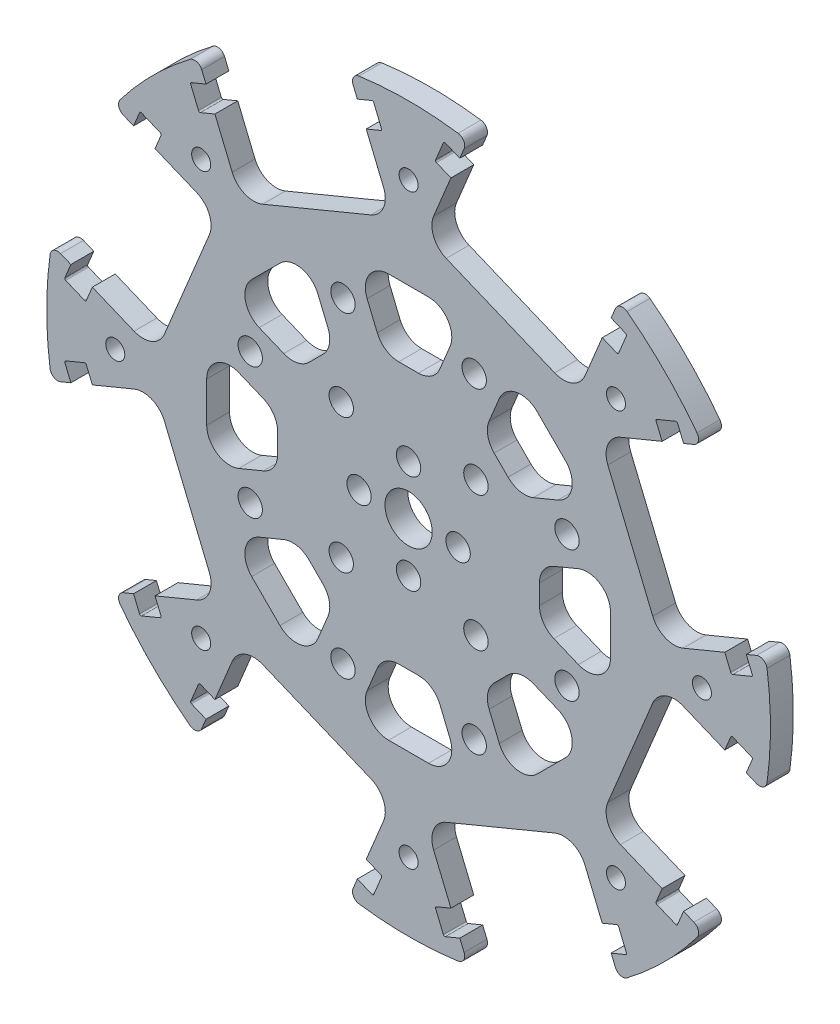
from build123d import *

# Parameters (mm, degrees)
SKETCH_1_R                       = 47.5
EXTRUDE_1_DEPTH                  = 3
CUT_EXTRUDE_1_DEPTH              = 68.242099908
CUT_EXTRUDE_2_DEPTH              = 68.242099908
CUT_EXTRUDE_2_DEPTH_BACK         = 68.242099908
SKETCH_3_R                       = 3.1
SKETCH_3_R_2                     = 1.6
SKETCH_4_R                       = 1.25
SKETCH_4_R_2                     = 1.6
CUT_EXTRUDE_3_DEPTH              = 68.242099908
CUT_EXTRUDE_4_DEPTH              = 68.242099908
FILLET_1_R                       = 1
FILLET_2_R                       = 0.2
FILLET_3_R                       = 3.05
FILLET_4_R                       = 3.05
PATTERN_CIRCULAR_1_COUNT         = 8
FILLET_1_OF_PATTERN_CIRCULAR_1_R = 1
FILLET_2_OF_PATTERN_CIRCULAR_1_R = 0.2
FILLET_3_OF_PATTERN_CIRCULAR_1_R = 3.05
FILLET_4_OF_PATTERN_CIRCULAR_1_R = 3.05


with BuildPart() as part:
    # ｽｹｯﾁ1 → ﾎﾞｽ - 押し出し1 (new body)
    with BuildSketch(Plane.XY):
        Circle(SKETCH_1_R)
    extrude(amount=EXTRUDE_1_DEPTH)

    # ｽｹｯﾁ2 → ｶｯﾄ - 押し出し1 (cut, through all)
    with BuildSketch(Plane.XY.offset(3)):
        Polygon((6.724591419, 44.32570355), (10.159175225, 52.617522355), (30.022585174, 44.389828559), (26.588001368, 36.098009755), (28.666730316, 35.236972032), (27.499545848, 32.419139458), (25.420816899, 33.28017718), (21.986233094, 24.988358376), (2.122823145, 33.216052172), (5.55740695, 41.507870976), (3.478678002, 42.368908699), (4.645862471, 45.186741273), align=None)
    cut_extrude_1 = extrude(amount=-CUT_EXTRUDE_1_DEPTH, mode=Mode.SUBTRACT)

    # ｽｹｯﾁ3 → ｶｯﾄ - 押し出し2 (cut, two sides: drawn at the far end of the back side and taken through both)
    with BuildSketch(Plane.XY.offset(3).offset(-CUT_EXTRUDE_2_DEPTH_BACK)):
        Circle(SKETCH_3_R)
        with Locations((0, 6.5)):
            Circle(SKETCH_3_R_2)
        with Locations((6.5, 0)):
            Circle(SKETCH_3_R_2)
        with Locations((0, -6.5)):
            Circle(SKETCH_3_R_2)
        with Locations((-6.5, 0)):
            Circle(SKETCH_3_R_2)
        with Locations((8.838834765, 8.838834765)):
            Circle(SKETCH_3_R_2)
        with Locations((8.838834765, -8.838834765)):
            Circle(SKETCH_3_R_2)
        with Locations((-8.838834765, -8.838834765)):
            Circle(SKETCH_3_R_2)
        with Locations((-8.838834765, 8.838834765)):
            Circle(SKETCH_3_R_2)
    extrude(amount=CUT_EXTRUDE_2_DEPTH + CUT_EXTRUDE_2_DEPTH_BACK, mode=Mode.SUBTRACT)

    # ｽｹｯﾁ4 → ｶｯﾄ - 押し出し3 (cut, through all)
    with BuildSketch(Plane.XY.offset(3)):
        with Locations((27.223611076, 27.223611076)):
            Circle(SKETCH_4_R)
        with Locations((8.610377228, 20.787289482)):
            Circle(SKETCH_4_R_2)
    cut_extrude_3 = extrude(amount=-CUT_EXTRUDE_3_DEPTH, mode=Mode.SUBTRACT)

    # ｽｹｯﾁ5 → ｶｯﾄ - 押し出し4 (cut, symmetric)
    with BuildSketch(Plane.XY.offset(3)):
        Polygon((3.328075632, 17.180626082), (7.188286702, 26.5), (-7.188286702, 26.5), (-3.328075632, 17.180626082), align=None)
    cut_extrude_4 = extrude(amount=CUT_EXTRUDE_4_DEPTH, both=True, mode=Mode.SUBTRACT)

    # ﾌｨﾚｯﾄ1
    fillet_1_edges = [part.edges().sort_by_distance(p)[0] for p in [
        (27.637535262, 38.631808716, 1.5),
        (7.774125313, 46.859502511, 1.5),
    ]]
    fillet(fillet_1_edges, radius=FILLET_1_R)

    # ﾌｨﾚｯﾄ2
    fillet_2_edges = [part.edges().sort_by_distance(p)[0] for p in [
        (28.666730316, 35.236972032, 1.5),
        (27.499545848, 32.419139458, 1.5),
        (4.645862471, 45.186741273, 1.5),
        (3.478678002, 42.368908699, 1.5),
    ]]
    fillet(fillet_2_edges, radius=FILLET_2_R)

    # ﾌｨﾚｯﾄ3
    fillet_3_edges = [part.edges().sort_by_distance(p)[0] for p in [
        (21.986233094, 24.988358376, 1.5),
        (2.122823145, 33.216052172, 1.5),
    ]]
    fillet(fillet_3_edges, radius=FILLET_3_R)

    # ﾌｨﾚｯﾄ4
    fillet_4_edges = [part.edges().sort_by_distance(p)[0] for p in [
        (7.188286702, 26.5, 1.5),
        (-7.188286702, 26.5, 1.5),
        (3.328075632, 17.180626082, 1.5),
        (-3.328075632, 17.180626082, 1.5),
    ]]
    fillet(fillet_4_edges, radius=FILLET_4_R)

    # 円形ﾊﾟﾀｰﾝ1: ｶｯﾄ - 押し出し1, ｶｯﾄ - 押し出し3, ｶｯﾄ - 押し出し4 ×8 about axis
    pattern_circular_1_axis = Axis((0, 0, 0), (0, 0, 1))
    add([cut_extrude_1.rotate(pattern_circular_1_axis, i * 360 / PATTERN_CIRCULAR_1_COUNT) for i in range(1, PATTERN_CIRCULAR_1_COUNT)], mode=Mode.SUBTRACT)
    add([cut_extrude_3.rotate(pattern_circular_1_axis, i * 360 / PATTERN_CIRCULAR_1_COUNT) for i in range(1, PATTERN_CIRCULAR_1_COUNT)], mode=Mode.SUBTRACT)
    add([cut_extrude_4.rotate(pattern_circular_1_axis, i * 360 / PATTERN_CIRCULAR_1_COUNT) for i in range(1, PATTERN_CIRCULAR_1_COUNT)], mode=Mode.SUBTRACT)

    # ﾌｨﾚｯﾄ1 of 円形ﾊﾟﾀｰﾝ1
    fillet_1_of_pattern_circular_1_edges = [part.edges().sort_by_distance(p)[0] for p in [
        (-7.774125313, 46.859502511, 1.5),
        (-27.637535262, 38.631808716, 1.5),
        (-38.631808716, 27.637535262, 1.5),
        (-46.859502511, 7.774125313, 1.5),
        (-46.859502511, -7.774125313, 1.5),
        (-38.631808716, -27.637535262, 1.5),
        (-27.637535262, -38.631808716, 1.5),
        (-7.774125313, -46.859502511, 1.5),
        (7.774125313, -46.859502511, 1.5),
        (27.637535262, -38.631808716, 1.5),
        (38.631808716, -27.637535262, 1.5),
        (46.859502511, -7.774125313, 1.5),
        (46.859502511, 7.774125313, 1.5),
        (38.631808716, 27.637535262, 1.5),
    ]]
    fillet(fillet_1_of_pattern_circular_1_edges, radius=FILLET_1_OF_PATTERN_CIRCULAR_1_R)

    # ﾌｨﾚｯﾄ2 of 円形ﾊﾟﾀｰﾝ1
    fillet_2_of_pattern_circular_1_edges = [part.edges().sort_by_distance(p)[0] for p in [
        (-4.645862471, 45.186741273, 1.5),
        (-3.478678002, 42.368908699, 1.5),
        (-28.666730316, 35.236972032, 1.5),
        (-27.499545848, 32.419139458, 1.5),
        (-35.236972032, 28.666730316, 1.5),
        (-32.419139458, 27.499545848, 1.5),
        (-45.186741273, 4.645862471, 1.5),
        (-42.368908699, 3.478678002, 1.5),
        (-45.186741273, -4.645862471, 1.5),
        (-42.368908699, -3.478678002, 1.5),
        (-35.236972032, -28.666730316, 1.5),
        (-32.419139458, -27.499545848, 1.5),
        (-28.666730316, -35.236972032, 1.5),
        (-27.499545848, -32.419139458, 1.5),
        (-4.645862471, -45.186741273, 1.5),
        (-3.478678002, -42.368908699, 1.5),
        (4.645862471, -45.186741273, 1.5),
        (3.478678002, -42.368908699, 1.5),
        (28.666730316, -35.236972032, 1.5),
        (27.499545848, -32.419139458, 1.5),
        (35.236972032, -28.666730316, 1.5),
        (32.419139458, -27.499545848, 1.5),
        (45.186741273, -4.645862471, 1.5),
        (42.368908699, -3.478678002, 1.5),
        (45.186741273, 4.645862471, 1.5),
        (42.368908699, 3.478678002, 1.5),
        (35.236972032, 28.666730316, 1.5),
        (32.419139458, 27.499545848, 1.5),
    ]]
    fillet(fillet_2_of_pattern_circular_1_edges, radius=FILLET_2_OF_PATTERN_CIRCULAR_1_R)

    # ﾌｨﾚｯﾄ3 of 円形ﾊﾟﾀｰﾝ1
    fillet_3_of_pattern_circular_1_edges = [part.edges().sort_by_distance(p)[0] for p in [
        (-2.122823145, 33.216052172, 1.5),
        (-21.986233094, 24.988358376, 1.5),
        (-24.988358376, 21.986233094, 1.5),
        (-33.216052172, 2.122823145, 1.5),
        (-33.216052172, -2.122823145, 1.5),
        (-24.988358376, -21.986233094, 1.5),
        (-21.986233094, -24.988358376, 1.5),
        (-2.122823145, -33.216052172, 1.5),
        (2.122823145, -33.216052172, 1.5),
        (21.986233094, -24.988358376, 1.5),
        (24.988358376, -21.986233094, 1.5),
        (33.216052172, -2.122823145, 1.5),
        (33.216052172, 2.122823145, 1.5),
        (24.988358376, 21.986233094, 1.5),
    ]]
    fillet(fillet_3_of_pattern_circular_1_edges, radius=FILLET_3_OF_PATTERN_CIRCULAR_1_R)

    # ﾌｨﾚｯﾄ4 of 円形ﾊﾟﾀｰﾝ1
    fillet_4_of_pattern_circular_1_edges = [part.edges().sort_by_distance(p)[0] for p in [
        (-13.655443429, 23.821215973, 1.5),
        (-23.821215973, 13.655443429, 1.5),
        (-9.79523236, 14.501842056, 1.5),
        (-14.501842056, 9.79523236, 1.5),
        (-26.5, 7.188286702, 1.5),
        (-26.5, -7.188286702, 1.5),
        (-17.180626082, 3.328075632, 1.5),
        (-17.180626082, -3.328075632, 1.5),
        (-23.821215973, -13.655443429, 1.5),
        (-13.655443429, -23.821215973, 1.5),
        (-14.501842056, -9.79523236, 1.5),
        (-9.79523236, -14.501842056, 1.5),
        (-7.188286702, -26.5, 1.5),
        (7.188286702, -26.5, 1.5),
        (-3.328075632, -17.180626082, 1.5),
        (3.328075632, -17.180626082, 1.5),
        (13.655443429, -23.821215973, 1.5),
        (23.821215973, -13.655443429, 1.5),
        (9.79523236, -14.501842056, 1.5),
        (14.501842056, -9.79523236, 1.5),
        (26.5, -7.188286702, 1.5),
        (26.5, 7.188286702, 1.5),
        (17.180626082, -3.328075632, 1.5),
        (17.180626082, 3.328075632, 1.5),
        (23.821215973, 13.655443429, 1.5),
        (13.655443429, 23.821215973, 1.5),
        (14.501842056, 9.79523236, 1.5),
        (9.79523236, 14.501842056, 1.5),
    ]]
    fillet(fillet_4_of_pattern_circular_1_edges, radius=FILLET_4_OF_PATTERN_CIRCULAR_1_R)


solid = part.part
